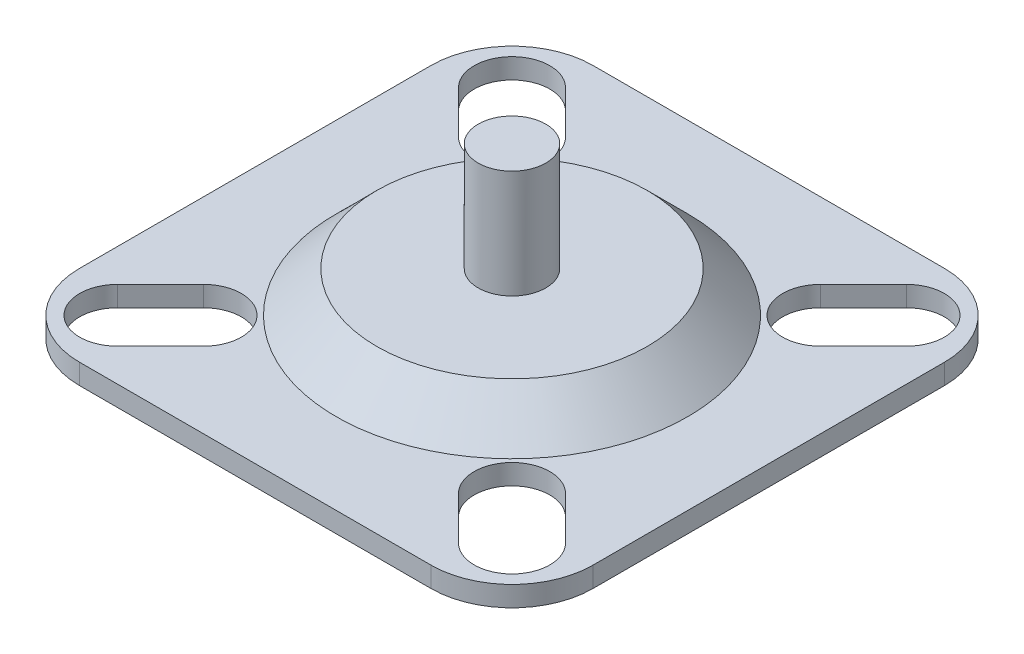
from build123d import *

# Parameters (mm, degrees)
BOSS_EXTRUDE1_DEPTH = 1.5
FILLET1_R           = 1
SKETCH5_R           = 2.5
BOSS_EXTRUDE2_DEPTH = 8


with BuildPart() as part:
    # Sketch1 → Boss-Extrude1 (new body)
    with BuildSketch(Plane(origin=(0, 0, 0), x_dir=(1, 0, 0), z_dir=(0, 1, 0))):
        with BuildLine():
            Line((-13, -19), (13, -19))
            ThreePointArc((13, -19), (17.242640687, -17.242640687), (19, -13))
            Line((19, -13), (19, 13))
            ThreePointArc((19, 13), (17.242640687, 17.242640687), (13, 19))
            Line((13, 19), (-13, 19))
            ThreePointArc((-13, 19), (-17.242640687, 17.242640687), (-19, 13))
            Line((-19, 13), (-19, -13))
            ThreePointArc((-19, -13), (-17.242640687, -17.242640687), (-13, -19))
        make_face()
        with BuildLine():
            Line((-12.61109127, 16.570889245), (-9.429110755, 13.38890873))
            ThreePointArc((-9.429110755, 13.38890873), (-9.429110755, 9.429110755), (-13.38890873, 9.429110755))
            Line((-13.38890873, 9.429110755), (-16.570889245, 12.61109127))
            ThreePointArc((-16.570889245, 12.61109127), (-16.570889245, 16.570889245), (-12.61109127, 16.570889245))
        make_face(mode=Mode.SUBTRACT)
        with BuildLine():
            Line((16.570889245, 12.61109127), (13.38890873, 9.429110755))
            ThreePointArc((13.38890873, 9.429110755), (9.429110755, 9.429110755), (9.429110755, 13.38890873))
            Line((9.429110755, 13.38890873), (12.61109127, 16.570889245))
            ThreePointArc((12.61109127, 16.570889245), (16.570889245, 16.570889245), (16.570889245, 12.61109127))
        make_face(mode=Mode.SUBTRACT)
        with BuildLine():
            Line((12.61109127, -16.570889245), (9.429110755, -13.38890873))
            ThreePointArc((9.429110755, -13.38890873), (9.429110755, -9.429110755), (13.38890873, -9.429110755))
            Line((13.38890873, -9.429110755), (16.570889245, -12.61109127))
            ThreePointArc((16.570889245, -12.61109127), (16.570889245, -16.570889245), (12.61109127, -16.570889245))
        make_face(mode=Mode.SUBTRACT)
        with BuildLine():
            Line((-16.570889245, -12.61109127), (-13.38890873, -9.429110755))
            ThreePointArc((-13.38890873, -9.429110755), (-9.429110755, -9.429110755), (-9.429110755, -13.38890873))
            Line((-9.429110755, -13.38890873), (-12.61109127, -16.570889245))
            ThreePointArc((-12.61109127, -16.570889245), (-16.570889245, -16.570889245), (-16.570889245, -12.61109127))
        make_face(mode=Mode.SUBTRACT)
    extrude(amount=BOSS_EXTRUDE1_DEPTH)

    # Sketch3 → Revolve1 (revolve)
    with BuildSketch(Plane(origin=(0, 0, 0), x_dir=(0, 0, -1), z_dir=(1, 0, 0))):
        Polygon((0, 1.5), (13, 1.5), (10, 4.5), (0, 4.5), align=None)
    revolve(axis=Axis((0, 4.5, 0), (0, -1, 0)))

    # Sketch4 → Cut-Revolve1 (revolve, cut)
    with BuildSketch(Plane(origin=(0, 0, 0), x_dir=(0, 0, -1), z_dir=(1, 0, 0)), mode=Mode.PRIVATE) as cut_revolve1_sk:
        Polygon((0, 0), (12, 0), (8, 4), (0, 4), align=None)
    revolve(cut_revolve1_sk.sketch.rotate(Axis((0, 4, 0), (0, -1, 0)), 180), axis=Axis((0, 4, 0), (0, -1, 0)), mode=Mode.SUBTRACT)

    # Fillet1
    fillet1_edges = [part.edges().sort_by_distance(p)[0] for p in [
        (0, 0, -12),
        (0, 4, -8),
    ]]
    fillet(fillet1_edges, radius=FILLET1_R)

    # Sketch5 → Boss-Extrude2 (add)
    with BuildSketch(Plane(origin=(0, 4.5, 0), x_dir=(1, 0, 0), z_dir=(0, 1, 0))):
        with Locations(Location((0, 0, 0), (0, 0, 90))):
            Circle(SKETCH5_R)
    extrude(amount=BOSS_EXTRUDE2_DEPTH)


solid = part.part
